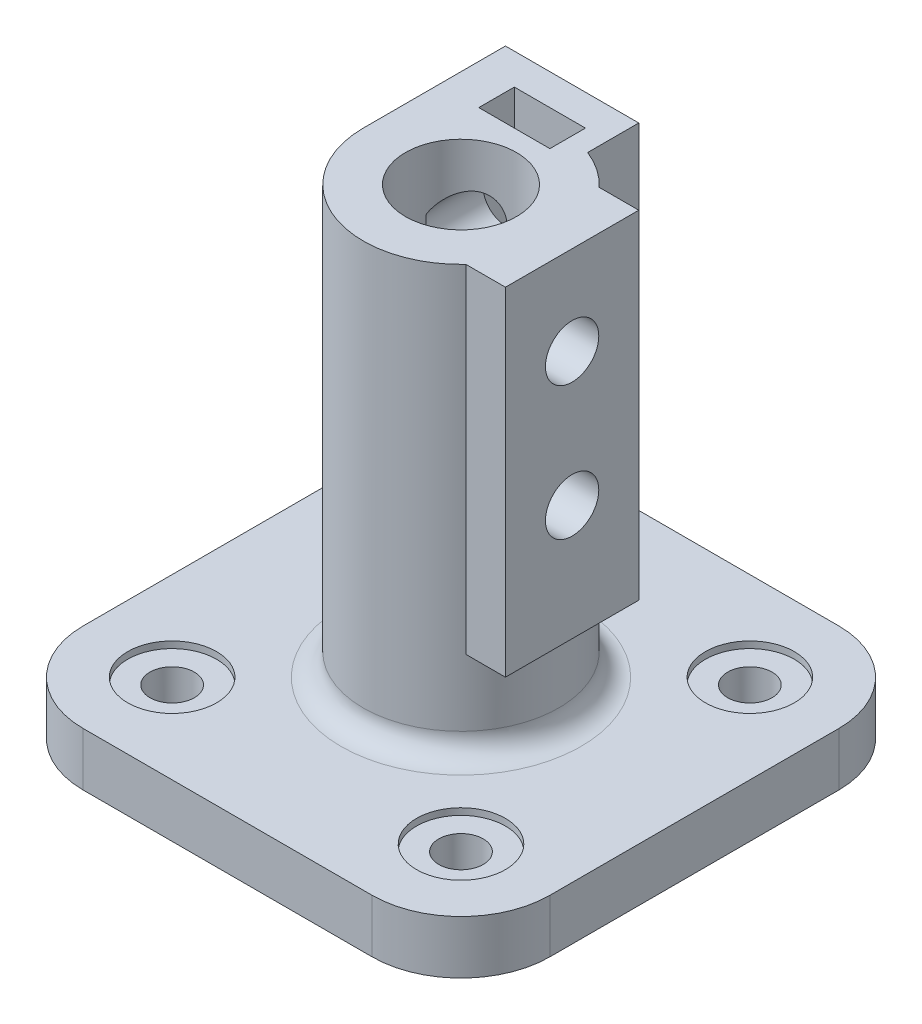
from build123d import *

# Parameters (mm, degrees)
BOSS_EXTRUDE2_DEPTH = 12
SKETCH2_R           = 5
CUT_EXTRUDE1_DEPTH  = 29
SKETCH3_R           = 10
CUT_EXTRUDE3_DEPTH  = 1.5
SKETCH4_R           = 22
SKETCH4_R_2         = 12.5
BOSS_EXTRUDE3_DEPTH = 96
BOSS_EXTRUDE4_START = -76
BOSS_EXTRUDE4_DEPTH = 76
BOSS_EXTRUDE5_START = -57
BOSS_EXTRUDE5_DEPTH = 57
SKETCH7_W           = 16
SKETCH7_H           = 8
CUT_EXTRUDE4_DEPTH  = 50
SKETCH8_R           = 6
CUT_EXTRUDE5_DEPTH  = 20
SKETCH9_R           = 5
CUT_EXTRUDE7_DEPTH  = 28
FILLET1_R           = 5


with BuildPart() as part:
    # Sketch1 → Boss-Extrude2 (new body)
    with BuildSketch(Plane(origin=(0, 0, 0), x_dir=(1, 0, 0), z_dir=(0, 1, 0))):
        with BuildLine():
            Line((-32.5, 52.5), (32.5, 52.5))
            ThreePointArc((32.5, 52.5), (46.642135624, 46.642135624), (52.5, 32.5))
            Line((52.5, 32.5), (52.5, -32.5))
            ThreePointArc((52.5, -32.5), (46.642135624, -46.642135624), (32.5, -52.5))
            Line((32.5, -52.5), (-32.5, -52.5))
            ThreePointArc((-32.5, -52.5), (-46.642135624, -46.642135624), (-52.5, -32.5))
            Line((-52.5, -32.5), (-52.5, 32.5))
            ThreePointArc((-52.5, 32.5), (-46.642135624, 46.642135624), (-32.5, 52.5))
        make_face()
    extrude(amount=BOSS_EXTRUDE2_DEPTH)

    # Sketch2 → Cut-Extrude1 (cut)
    with BuildSketch(Plane(origin=(0, 12, 0), x_dir=(1, 0, 0), z_dir=(0, 1, 0))):
        with Locations(Location((-32.5, 32.5, 0), (0, 0, 270))):
            Circle(SKETCH2_R)
        with Locations(Location((32.5, 32.5, 0), (0, 0, 270))):
            Circle(SKETCH2_R)
        with Locations(Location((32.5, -32.5, 0), (0, 0, 270))):
            Circle(SKETCH2_R)
        with Locations(Location((-32.5, -32.5, 0), (0, 0, 270))):
            Circle(SKETCH2_R)
    extrude(amount=-CUT_EXTRUDE1_DEPTH, mode=Mode.SUBTRACT)

    # Sketch3 → Cut-Extrude3 (cut)
    with BuildSketch(Plane(origin=(0, 12, 0), x_dir=(1, 0, 0), z_dir=(0, 1, 0))):
        with Locations(Location((-32.5, 32.5, 0), (0, 0, 270))):
            Circle(SKETCH3_R)
        with Locations(Location((32.5, 32.5, 0), (0, 0, 90))):
            Circle(SKETCH3_R)
        with Locations(Location((-32.5, -32.5, 0), (0, 0, 90))):
            Circle(SKETCH3_R)
        with Locations(Location((32.5, -32.5, 0), (0, 0, 270))):
            Circle(SKETCH3_R)
    extrude(amount=-CUT_EXTRUDE3_DEPTH, mode=Mode.SUBTRACT)

    # Sketch4 → Boss-Extrude3 (add)
    with BuildSketch(Plane(origin=(0, 12, 0), x_dir=(1, 0, 0), z_dir=(0, 1, 0))):
        with Locations(Location((0, 0, 0), (0, 0, 270))):
            Circle(SKETCH4_R)
        with Locations(Location((0, 0, 0), (0, 0, 270))):
            Circle(SKETCH4_R_2, mode=Mode.SUBTRACT)
    extrude(amount=BOSS_EXTRUDE3_DEPTH)

    # Sketch5 → Boss-Extrude4 (add)
    with BuildSketch(Plane(origin=(0, 108, 0), x_dir=(1, 0, 0), z_dir=(0, 1, 0)).offset(BOSS_EXTRUDE4_START)):
        with BuildLine():
            Line((25, 15), (25, -15))
            Line((25, -15), (16.093476939, -15))
            ThreePointArc((16.093476939, -15), (22, 0), (16.093476939, 15))
            Line((16.093476939, 15), (25, 15))
        make_face()
    extrude(amount=BOSS_EXTRUDE4_DEPTH)

    # Sketch6 → Boss-Extrude5 (add)
    with BuildSketch(Plane(origin=(0, 108, 0), x_dir=(1, 0, 0), z_dir=(0, 1, 0)).offset(BOSS_EXTRUDE5_START)):
        with BuildLine():
            Line((8, 20.493901532), (8, 32))
            Line((8, 32), (-22, 32))
            Line((-22, 32), (-22, 0))
            ThreePointArc((-22, 0), (-12.409673646, 18.165902125), (8, 20.493901532))
        make_face()
    extrude(amount=BOSS_EXTRUDE5_DEPTH)

    # Sketch7 → Cut-Extrude4 (cut)
    with BuildSketch(Plane(origin=(0, 108, 0), x_dir=(1, 0, 0), z_dir=(0, 1, 0))):
        with Locations((-5, 21)):
            Rectangle(SKETCH7_W, SKETCH7_H)
    extrude(amount=-CUT_EXTRUDE4_DEPTH, mode=Mode.SUBTRACT)

    # Sketch8 → Cut-Extrude5 (cut)
    with BuildSketch(Plane(origin=(25, 0, 0), x_dir=(0, 0, -1), z_dir=(1, 0, 0))):
        with Locations((0, 88)):
            Circle(SKETCH8_R)
        with Locations((0, 58)):
            Circle(SKETCH8_R)
    extrude(amount=-CUT_EXTRUDE5_DEPTH, mode=Mode.SUBTRACT)

    # Sketch9 → Cut-Extrude7 (cut)
    with BuildSketch(Plane(origin=(0, 0, -32), x_dir=(-1, 0, 0), z_dir=(0, 0, -1))):
        with Locations(Location((7, 93, 0), (0, 0, 345.590947366))):
            Circle(SKETCH9_R)
        with Locations(Location((7, 71, 0), (0, 0, 345.590947366))):
            Circle(SKETCH9_R)
    extrude(amount=-CUT_EXTRUDE7_DEPTH, mode=Mode.SUBTRACT)

    # Fillet1
    fillet1_edges = [part.edges().sort_by_distance(p)[0] for p in [
        (0, 12, -22),
    ]]
    fillet(fillet1_edges, radius=FILLET1_R)


solid = part.part
